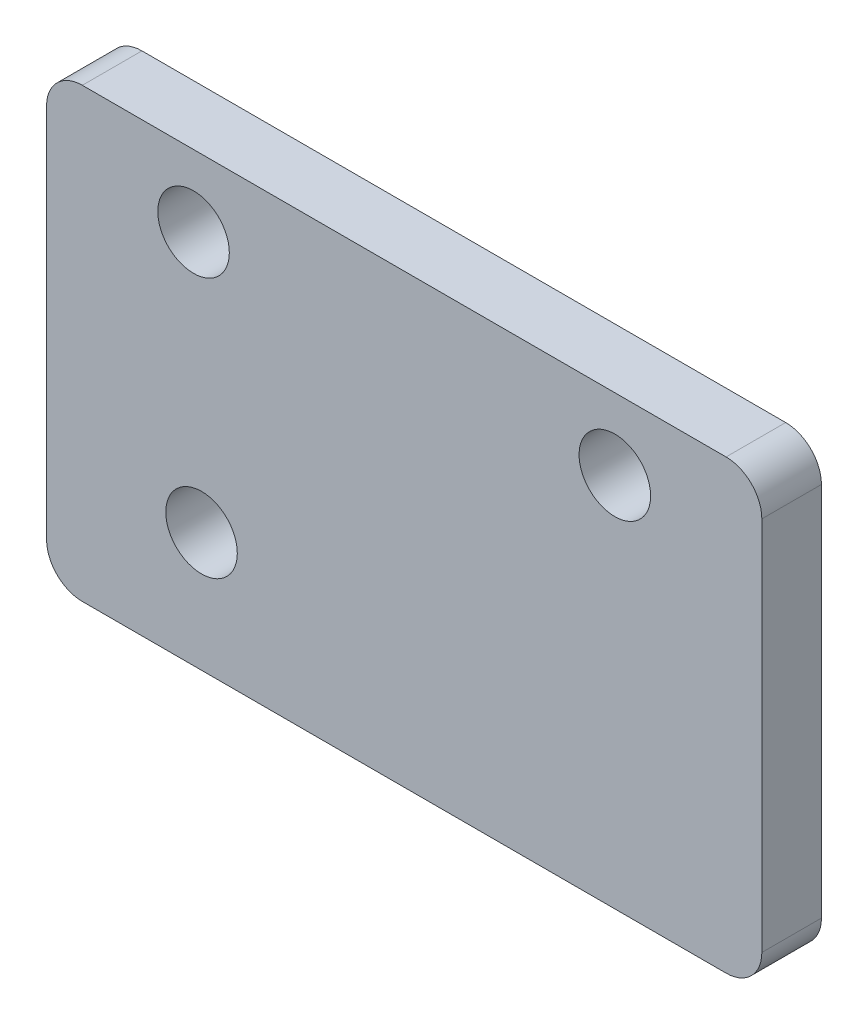
from build123d import *

# Parameters (mm, degrees)
EXTRUDE_1_DEPTH     = 5
SKETCH_2_R          = 3
CUT_EXTRUDE_1_DEPTH = 10
SKETCH_4_R          = 3
CUT_EXTRUDE_2_DEPTH = 10


with BuildPart() as part:
    # 草图1 → 凸台-拉伸1 (new body)
    with BuildSketch(Plane.XY):
        with BuildLine():
            Line((-15.5, 27.5), (38.5, 27.5))
            ThreePointArc((38.5, 27.5), (40.621320344, 26.621320344), (41.5, 24.5))
            Line((41.5, 24.5), (41.5, -7))
            ThreePointArc((41.5, -7), (40.621320344, -9.121320344), (38.5, -10))
            Line((38.5, -10), (33.3, -10))
            Line((33.3, -10), (31.175, -10))
            Line((31.175, -10), (-8.825, -10))
            Line((-8.825, -10), (-15.5, -10))
            ThreePointArc((-15.5, -10), (-17.621320344, -9.121320344), (-18.5, -7))
            Line((-18.5, -7), (-18.5, 24.5))
            ThreePointArc((-18.5, 24.5), (-17.621320344, 26.621320344), (-15.5, 27.5))
        make_face()
    extrude(amount=EXTRUDE_1_DEPTH)

    # 草图2 → 切除-拉伸1 (cut)
    with BuildSketch(Plane.XY.offset(5)):
        with Locations((-6.17, 21.5)):
            Circle(SKETCH_2_R)
        with Locations((29.17, 21.5)):
            Circle(SKETCH_2_R)
    extrude(amount=-CUT_EXTRUDE_1_DEPTH, mode=Mode.SUBTRACT)

    # 草图4 → 切除-拉伸2 (cut)
    with BuildSketch(Plane.XY.offset(5)):
        with Locations((-5.5, 0)):
            Circle(SKETCH_4_R)
    extrude(amount=-CUT_EXTRUDE_2_DEPTH, mode=Mode.SUBTRACT)


solid = part.part
